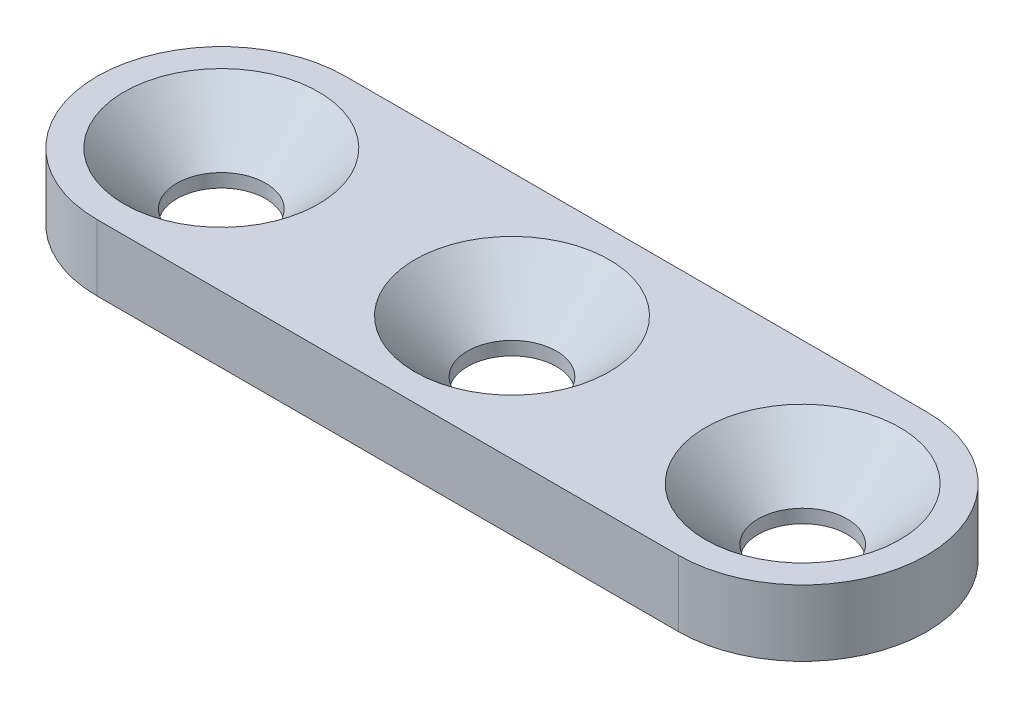
from build123d import *

# Parameters (mm, degrees)
BOSS_EXTRUDE2_DEPTH                          = 3.2
CSK_FOR_M4_COUNTERSUNK_FLAT_HEAD1_AT_2_COUNT = 2
CSK_FOR_M4_COUNTERSUNK_FLAT_HEAD1_AT_2_PITCH = 14.05
CSK_FOR_M4_COUNTERSUNK_FLAT_HEAD1_AT_3_COUNT = 2
CSK_FOR_M4_COUNTERSUNK_FLAT_HEAD1_AT_3_PITCH = 14.05


with BuildPart() as part:
    # Sketch3 → Boss-Extrude2 (new body)
    with BuildSketch(Plane(origin=(0, 0, 0), x_dir=(1, 0, 0), z_dir=(0, 1, 0))):
        with BuildLine():
            Line((-14.05, 6), (14.05, 6))
            ThreePointArc((14.05, 6), (20.05, 0), (14.05, -6))
            Line((14.05, -6), (-14.05, -6))
            ThreePointArc((-14.05, -6), (-20.05, 0), (-14.05, 6))
        make_face()
    extrude(amount=BOSS_EXTRUDE2_DEPTH)

    # Sketch5 → CSK for M4 Countersunk Flat Head1 (revolve, cut)
    with BuildSketch(Plane(origin=(0, 3.2, 0), x_dir=(0, 0, 1), z_dir=(1, 0, 0))):
        Polygon((0, 0), (0, 3.2), (2.15, 3.2), (2.15, 2.55), (4.7, 0), align=None)
    csk_for_m4_countersunk_flat_head1 = revolve(axis=Axis((0, 9.55, 0), (0, -1, 0)), mode=Mode.SUBTRACT)

    # CSK for M4 Countersunk Flat Head1 at 2: CSK for M4 Countersunk Flat Head1 ×2
    with Locations(*[(i * CSK_FOR_M4_COUNTERSUNK_FLAT_HEAD1_AT_2_PITCH, 0, 0) for i in range(1, CSK_FOR_M4_COUNTERSUNK_FLAT_HEAD1_AT_2_COUNT)]):
        add(csk_for_m4_countersunk_flat_head1, mode=Mode.SUBTRACT)

    # CSK for M4 Countersunk Flat Head1 at 3: CSK for M4 Countersunk Flat Head1 ×2
    with Locations(*[(-i * CSK_FOR_M4_COUNTERSUNK_FLAT_HEAD1_AT_3_PITCH, 0, 0) for i in range(1, CSK_FOR_M4_COUNTERSUNK_FLAT_HEAD1_AT_3_COUNT)]):
        add(csk_for_m4_countersunk_flat_head1, mode=Mode.SUBTRACT)


solid = part.part
